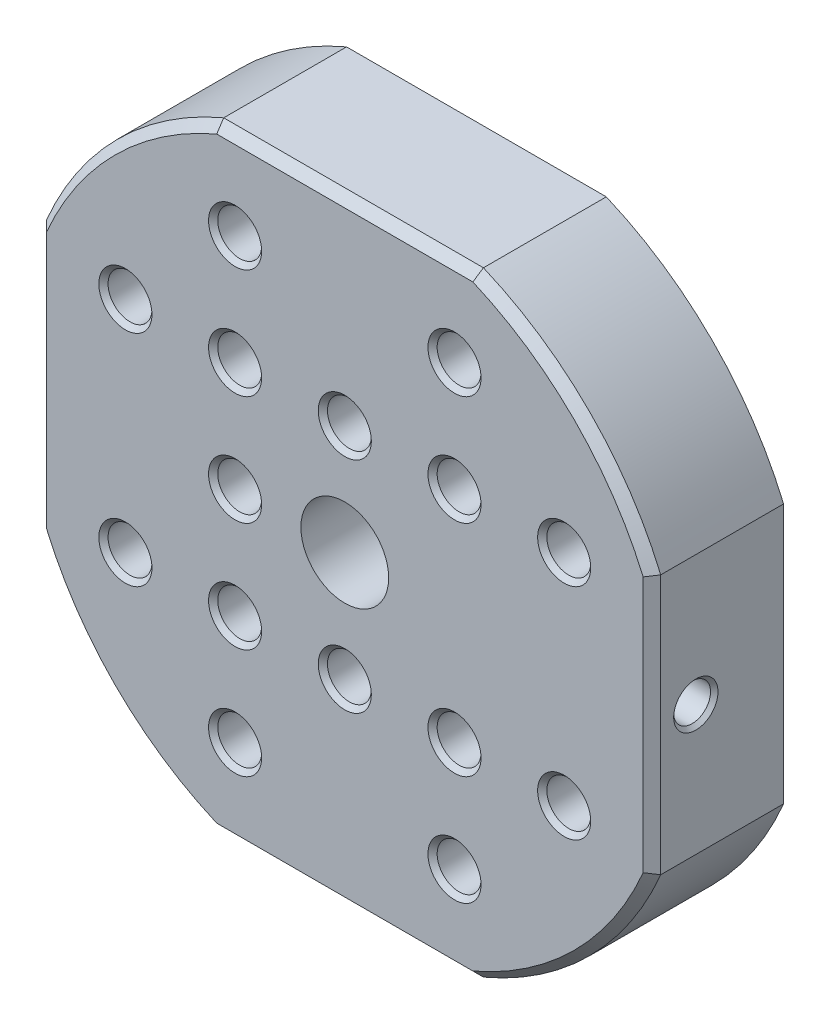
from build123d import *

# Parameters (mm, degrees)
SKIZZE1_R                       = 5
AUFSATZ_LINEAR_AUSTRAGEN1_DEPTH = 15
SKIZZE4_R                       = 24.75
AUFSATZ_LINEAR_AUSTRAGEN2_DEPTH = 3
SKIZZE2_R                       = 2.5
SCHNITT_LINEAR_AUSTRAGEN1_DEPTH = 20
M6_GEWINDEBOHRUNG1_D            = 5
M6_GEWINDEBOHRUNG1_DEPTH        = 10
M6_GEWINDEBOHRUNG1_CSINK_D      = 6.05
M6_GEWINDEBOHRUNG1_CSINK_ANGLE  = 90
M6_GEWINDEBOHRUNG1_TIP          = 1.502151548
SCHNITT_LINEAR_START            = -13.25
SKIZZE5_R                       = 5
SCHNITT_LINEAR_AUSTRAGEN2_DEPTH = 13.25
SKIZZE6_R                       = 60.631452858
SKIZZE6_R_2                     = 38
SCHNITT_LINEAR_AUSTRAGEN3_DEPTH = 17
FASE1_SIZE                      = 1
SKIZZE7_R                       = 2
SCHNITT_LINEAR_AUSTRAGEN4_DEPTH = 38
M5_GEWINDEBOHRUNG1_D            = 4.2
M5_GEWINDEBOHRUNG1_DEPTH        = 34
M5_GEWINDEBOHRUNG1_CSINK_D      = 5.05
M5_GEWINDEBOHRUNG1_CSINK_ANGLE  = 90
M5_GEWINDEBOHRUNG1_TIP          = 1.2618073
SKIZZE10_R                      = 15.05
SCHNITT_LINEAR_AUSTRAGEN5_DEPTH = 0.5


with BuildPart() as part:
    # Skizze1 → Aufsatz-Linear austragen1 (new body)
    with BuildSketch(Plane.XY):
        with BuildLine():
            Line((-36.910459775, 30.503472222), (29.089540225, 30.503472222))
            ThreePointArc((29.089540225, 30.503472222), (30.503753788, 29.917685785), (31.089540225, 28.503472222))
            Line((31.089540225, 28.503472222), (31.089540225, -37.496527778))
            ThreePointArc((31.089540225, -37.496527778), (30.503753788, -38.91074134), (29.089540225, -39.496527778))
            Line((29.089540225, -39.496527778), (-36.910459775, -39.496527778))
            ThreePointArc((-36.910459775, -39.496527778), (-38.324673337, -38.91074134), (-38.910459775, -37.496527778))
            Line((-38.910459775, -37.496527778), (-38.910459775, 28.503472222))
            ThreePointArc((-38.910459775, 28.503472222), (-38.324673337, 29.917685785), (-36.910459775, 30.503472222))
        make_face()
        with Locations((-3.910459775, -4.496527778)):
            Circle(SKIZZE1_R, mode=Mode.SUBTRACT)
    extrude(amount=AUFSATZ_LINEAR_AUSTRAGEN1_DEPTH)

    # Skizze4 → Aufsatz-Linear austragen2 (add)
    with BuildSketch(Plane(origin=(0, 0, 0), x_dir=(-1, 0, 0), z_dir=(0, 0, -1))):
        with Locations((3.910459775, -4.496527778)):
            Circle(SKIZZE4_R)
    extrude(amount=AUFSATZ_LINEAR_AUSTRAGEN2_DEPTH)

    # Skizze2 → Schnitt-Linear austragen1 (cut)
    with BuildSketch(Plane.XY.offset(15)):
        with Locations((-16.410459775, 20.503472222)):
            Circle(SKIZZE2_R)
        with Locations((8.589540225, 20.503472222)):
            Circle(SKIZZE2_R)
        with Locations((-16.410459775, 8.003472222)):
            Circle(SKIZZE2_R)
        with Locations((-3.910459775, 8.003472222)):
            Circle(SKIZZE2_R)
        with Locations((8.589540225, 8.003472222)):
            Circle(SKIZZE2_R)
        with Locations((21.089540225, 8.003472222)):
            Circle(SKIZZE2_R)
        with Locations((-16.410459775, -4.496527778)):
            Circle(SKIZZE2_R)
        with Locations((-16.410459775, -16.996527778)):
            Circle(SKIZZE2_R)
        with Locations((-3.910459775, -16.996527778)):
            Circle(SKIZZE2_R)
        with Locations((8.589540225, -16.996527778)):
            Circle(SKIZZE2_R)
        with Locations((21.089540225, -16.996527778)):
            Circle(SKIZZE2_R)
        with Locations((-16.410459775, -29.496527778)):
            Circle(SKIZZE2_R)
        with Locations((8.589540225, -29.496527778)):
            Circle(SKIZZE2_R)
        with Locations((-28.910459775, 8.003472222)):
            Circle(SKIZZE2_R)
        with Locations((-28.910459775, -16.996527778)):
            Circle(SKIZZE2_R)
    extrude(amount=-SCHNITT_LINEAR_AUSTRAGEN1_DEPTH, mode=Mode.SUBTRACT)

    # M6 Gewindebohrung1
    with Locations(Plane(origin=(-16.410459775, 20.503472222, 15), x_dir=(1, 0, 0), z_dir=(0, 0, 1))):
        with Locations((0, 0), (25, 0), (37.5, -12.5), (25, -12.5), (12.5, -12.5), (0, -12.5), (-12.5, -12.5), (0, -25), (37.5, -37.5), (25, -37.5), (12.5, -37.5), (0, -37.5), (-12.5, -37.5), (0, -50), (25, -50)):
            CounterSinkHole(M6_GEWINDEBOHRUNG1_D / 2, M6_GEWINDEBOHRUNG1_CSINK_D / 2, depth=M6_GEWINDEBOHRUNG1_DEPTH, counter_sink_angle=M6_GEWINDEBOHRUNG1_CSINK_ANGLE)
            with Locations((0, 0, -(M6_GEWINDEBOHRUNG1_DEPTH + M6_GEWINDEBOHRUNG1_TIP / 2))):  # 118° drill point
                Cone(0, M6_GEWINDEBOHRUNG1_D / 2, M6_GEWINDEBOHRUNG1_TIP, mode=Mode.SUBTRACT)

    # Skizze5 → Schnitt-Linear austragen2 (cut)
    with BuildSketch(Plane.XY.offset(SCHNITT_LINEAR_START)):
        with Locations(Location((-3.910459775, -4.496527778, 0), (0, 0, 180))):
            Circle(SKIZZE5_R)
    extrude(amount=SCHNITT_LINEAR_AUSTRAGEN2_DEPTH, mode=Mode.SUBTRACT)

    # Skizze6 → Schnitt-Linear austragen3 (cut)
    with BuildSketch(Plane.XY.offset(15)):
        with Locations((-3.910459775, -4.496527778)):
            Circle(SKIZZE6_R)
        with Locations((-3.910459775, -4.496527778)):
            Circle(SKIZZE6_R_2, mode=Mode.SUBTRACT)
    extrude(amount=-SCHNITT_LINEAR_AUSTRAGEN3_DEPTH, mode=Mode.SUBTRACT)

    # Fase1
    fase1_edges = [part.edges().sort_by_distance(p)[0] for p in [
        (-38.910459775, -4.496527778, 15),
        (-3.910459775, 30.503472222, 15),
        (31.089540225, -4.496527778, 15),
        (-3.910459775, -39.496527778, 15),
        (22.95959791, -31.366585463, 15),
        (22.95959791, 22.373529907, 15),
        (-30.78051746, 22.373529907, 15),
        (-30.78051746, -31.366585463, 15),
    ]]
    chamfer(fase1_edges, length=FASE1_SIZE)

    # Skizze7 → Schnitt-Linear austragen4 (cut)
    with BuildSketch(Plane(origin=(31.089540225, 0, 0), x_dir=(0, 0, -1), z_dir=(1, 0, 0))):
        with Locations(Location((-10, -4.496527778, 0), (0, 0, 90))):
            Circle(SKIZZE7_R)
    extrude(amount=-SCHNITT_LINEAR_AUSTRAGEN4_DEPTH, mode=Mode.SUBTRACT)

    # M5 Gewindebohrung1
    with Locations(Plane(origin=(31.089540225, -4.496527778, 10), x_dir=(0, 1, 0), z_dir=(1, 0, 0))):
        with Locations((0, 0)):
            CounterSinkHole(M5_GEWINDEBOHRUNG1_D / 2, M5_GEWINDEBOHRUNG1_CSINK_D / 2, depth=M5_GEWINDEBOHRUNG1_DEPTH, counter_sink_angle=M5_GEWINDEBOHRUNG1_CSINK_ANGLE)
            with Locations((0, 0, -(M5_GEWINDEBOHRUNG1_DEPTH + M5_GEWINDEBOHRUNG1_TIP / 2))):  # 118° drill point
                Cone(0, M5_GEWINDEBOHRUNG1_D / 2, M5_GEWINDEBOHRUNG1_TIP, mode=Mode.SUBTRACT)

    # Skizze10 → Schnitt-Linear austragen5 (cut)
    with BuildSketch(Plane(origin=(0, 0, -3), x_dir=(-1, 0, 0), z_dir=(0, 0, -1))):
        with Locations((3.910459775, -4.496527778)):
            Circle(SKIZZE10_R)
    extrude(amount=-SCHNITT_LINEAR_AUSTRAGEN5_DEPTH, mode=Mode.SUBTRACT)


solid = part.part
